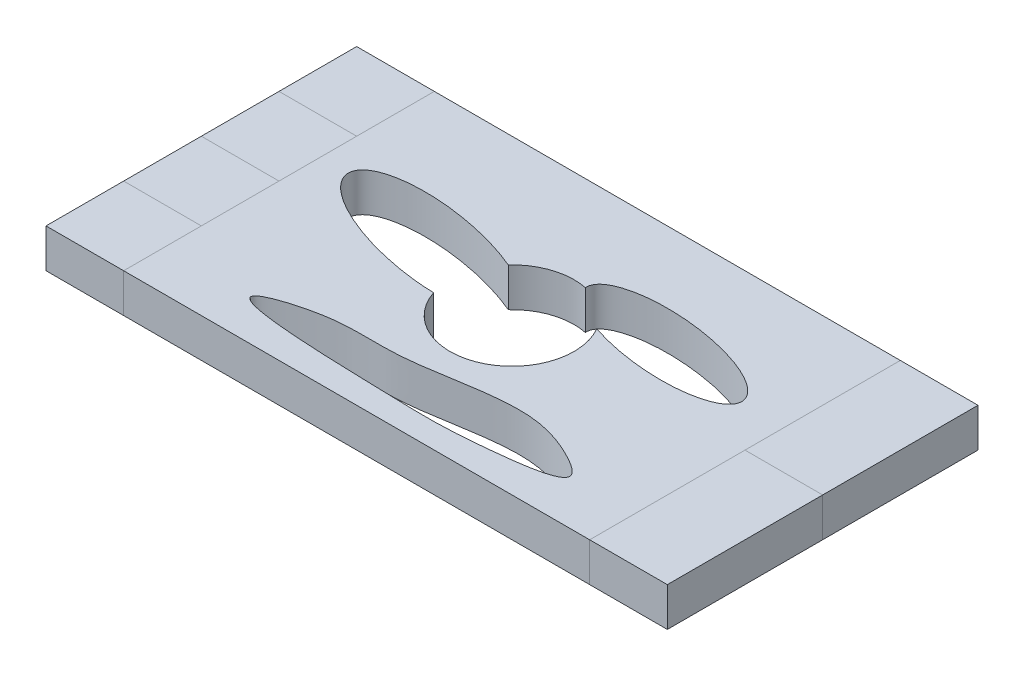
from build123d import *

# Parameters (mm, degrees)
SKETCH1_W           = 38.1
SKETCH1_H           = 25.4
SKETCH1_R           = 5.08
BOSS_EXTRUDE1_DEPTH = 3.175
SKETCH2_W           = 6.35
SKETCH2_H           = 3.175
BOSS_EXTRUDE3_DEPTH = 6.35
SKETCH2_4_W         = 6.35
SKETCH2_4_H         = 3.175
BOSS_EXTRUDE4_DEPTH = 6.35
SKETCH2_6_W         = 6.35
SKETCH2_6_H         = 3.175
BOSS_EXTRUDE6_DEPTH = 6.35
SKETCH2_7_W         = 6.35
SKETCH2_7_H         = 3.175
BOSS_EXTRUDE7_DEPTH = 6.35
SKETCH4_W           = 12.7
SKETCH4_H           = 3.175
BOSS_EXTRUDE8_DEPTH = 6.35
SKETCH4_3_W         = 12.7
SKETCH4_3_H         = 3.175
BOSS_EXTRUDE9_DEPTH = 6.35
SKETCH6_RX          = 8.57451924
SKETCH6_RY          = 2.943953473
SKETCH6_RX_2        = 7.289930047
SKETCH6_RY_2        = 2.506832752
CUT_EXTRUDE1_DEPTH  = 29.575
CUT_EXTRUDE2_DEPTH  = 29.575000056


with BuildPart() as part:
    # Sketch1 → Boss-Extrude1 (new body)
    with BuildSketch(Plane(origin=(0, 0, 0), x_dir=(1, 0, 0), z_dir=(0, 1, 0))):
        Rectangle(SKETCH1_W, SKETCH1_H)
        Circle(SKETCH1_R, mode=Mode.SUBTRACT)
    extrude(amount=BOSS_EXTRUDE1_DEPTH)

    # Sketch6 → Cut-Extrude1 (cut, through all)
    with BuildSketch(Plane(origin=(0, 3.175, 0), x_dir=(1, 0, 0), z_dir=(0, 1, 0))):
        with Locations(Location((-8.380784801, 1.812408983), (0, 0, -12.202737687))):
            Ellipse(SKETCH6_RX, SKETCH6_RY)
        with Locations(Location((8.25298518, 4.197573784), (0, 0, 172.045272206))):
            Ellipse(SKETCH6_RX_2, SKETCH6_RY_2)
    extrude(amount=-CUT_EXTRUDE1_DEPTH, mode=Mode.SUBTRACT)

    # Sketch7 → Cut-Extrude2 (cut, through all)
    with BuildSketch(Plane(origin=(0, 3.175, 0), x_dir=(1, 0, 0), z_dir=(0, 1, 0))):
        with BuildLine():
            add(Edge.make_bspline(
                [(-7.729678553, -7.704083591), (-5.593166835, -7.345374411), (-1.159100469, -7.866320115), (5.837548536, -5.861172246), (10.730412338, -6.792796164), (15.45180073, -9.571129645), (5.89022341, -10.835176772), (1.731031847, -10.628198791), (-16.504446605, -10.237014881), (-9.361821969, -7.978111962), (-7.729678553, -7.704083591)],
                knots=[0, 0, 0, 0, 0.107817098, 0.283313546, 0.376887179, 0.422530436, 0.516047701, 0.689425402, 0.917635385, 1, 1, 1, 1], degree=3))
        make_face()
    extrude(amount=-CUT_EXTRUDE2_DEPTH, mode=Mode.SUBTRACT)


with BuildPart() as body_2:
    # Sketch2 → Boss-Extrude3 (new body)
    with BuildSketch(Plane.ZY.offset(19.05)):
        with Locations((-9.525, 1.5875)):
            Rectangle(SKETCH2_W, SKETCH2_H)
    extrude(amount=BOSS_EXTRUDE3_DEPTH)


with BuildPart() as body_3:
    # Sketch2<4> → Boss-Extrude4 (new body)
    with BuildSketch(Plane.ZY.offset(19.05)):
        with Locations((-3.175, 1.5875)):
            Rectangle(SKETCH2_4_W, SKETCH2_4_H)
    extrude(amount=BOSS_EXTRUDE4_DEPTH)


with BuildPart() as body_4:
    # Sketch2<6> → Boss-Extrude6 (new body)
    with BuildSketch(Plane.ZY.offset(19.05)):
        with Locations((3.175, 1.5875)):
            Rectangle(SKETCH2_6_W, SKETCH2_6_H)
    extrude(amount=BOSS_EXTRUDE6_DEPTH)


with BuildPart() as body_5:
    # Sketch2<7> → Boss-Extrude7 (new body)
    with BuildSketch(Plane.ZY.offset(19.05)):
        with Locations((9.525, 1.5875)):
            Rectangle(SKETCH2_7_W, SKETCH2_7_H)
    extrude(amount=BOSS_EXTRUDE7_DEPTH)


with BuildPart() as body_6:
    # Sketch4 → Boss-Extrude8 (new body)
    with BuildSketch(Plane(origin=(19.05, 0, 0), x_dir=(0, 0, -1), z_dir=(1, 0, 0))):
        with Locations((-6.35, 1.5875)):
            Rectangle(SKETCH4_W, SKETCH4_H)
    extrude(amount=BOSS_EXTRUDE8_DEPTH)


with BuildPart() as body_7:
    # Sketch4<3> → Boss-Extrude9 (new body)
    with BuildSketch(Plane(origin=(19.05, 0, 0), x_dir=(0, 0, -1), z_dir=(1, 0, 0))):
        with Locations((6.35, 1.5875)):
            Rectangle(SKETCH4_3_W, SKETCH4_3_H)
    extrude(amount=BOSS_EXTRUDE9_DEPTH)


solid = Compound([part.part, body_2.part, body_3.part, body_4.part, body_5.part, body_6.part, body_7.part])
